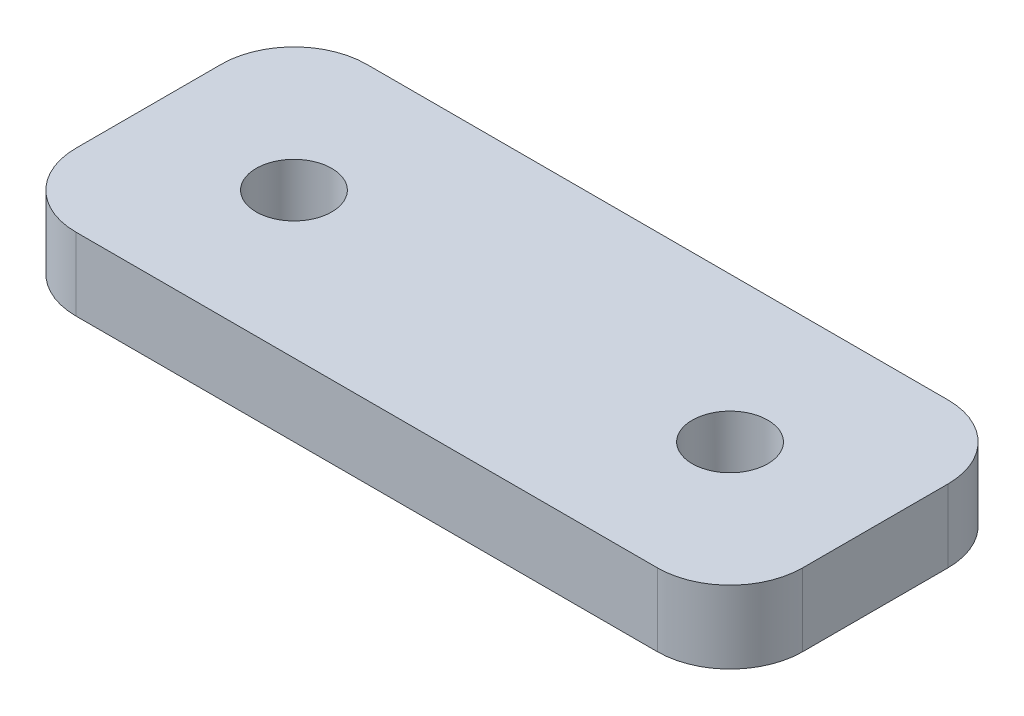
from build123d import *

# Parameters (mm, degrees)
ESBO_O1_W                = 50
ESBO_O1_H                = 20
RESSALTO_EXTRUS_O1_DEPTH = 2.5
ESBO_O2_R                = 2.6
CORTE_EXTRUS_O1_DEPTH    = 6
FILETE1_R                = 5


with BuildPart() as part:
    # Esboço1 → Ressalto-extrusão1 (new, symmetric)
    with BuildSketch(Plane(origin=(0, 0, 0), x_dir=(1, 0, 0), z_dir=(0, 1, 0))):
        Rectangle(ESBO_O1_W, ESBO_O1_H)
    extrude(amount=RESSALTO_EXTRUS_O1_DEPTH, both=True)

    # Esboço2 → Corte-extrusão1 (cut)
    with BuildSketch(Plane(origin=(0, 2.5, 0), x_dir=(1, 0, 0), z_dir=(0, 1, 0))):
        with Locations(Location((-15, 0, 0), (0, 0, 270))):
            Circle(ESBO_O2_R)
        with Locations(Location((15, 0, 0), (0, 0, 270))):
            Circle(ESBO_O2_R)
    extrude(amount=-CORTE_EXTRUS_O1_DEPTH, mode=Mode.SUBTRACT)

    # Filete1
    filete1_edges = [part.edges().sort_by_distance(p)[0] for p in [
        (25, 0, 10),
        (-25, 0, 10),
        (-25, 0, -10),
        (25, 0, -10),
    ]]
    fillet(filete1_edges, radius=FILETE1_R)


solid = part.part
